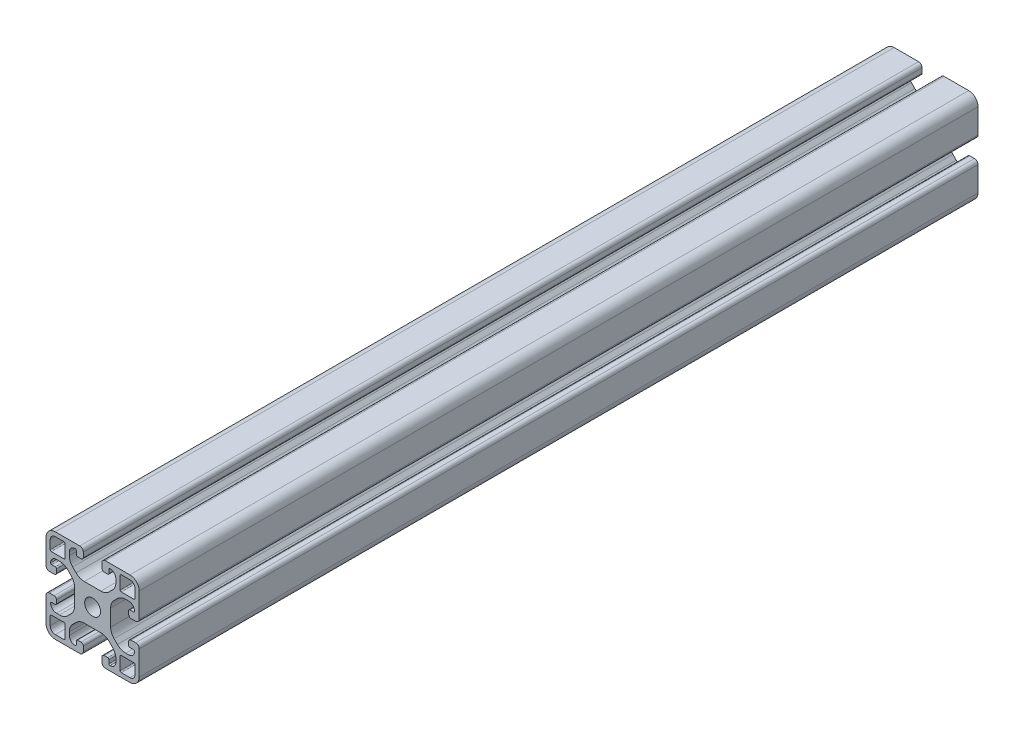
from build123d import *

# Parameters (mm, degrees)
SKETCH1_R          = 3.4
BASE_EXTRUDE_DEPTH = 360


with BuildPart() as part:
    # Sketch1 → Base-Extrude (new body)
    with BuildSketch(Plane.XY):
        with BuildLine():
            Line((226.84498689, 367.654619736), (226.84498689, 357.154619736))
            ThreePointArc((226.84498689, 357.154619736), (227.284326718, 356.093959564), (228.34498689, 355.654619736))
            Line((228.34498689, 355.654619736), (230.34498689, 355.654619736))
            ThreePointArc((230.34498689, 355.654619736), (231.052093671, 355.947512955), (231.34498689, 356.654619736))
            Line((231.34498689, 356.654619736), (231.34498689, 358.154619736))
            ThreePointArc((231.34498689, 358.154619736), (231.19854028, 358.508173127), (230.84498689, 358.654619736))
            Line((230.84498689, 358.654619736), (229.34498689, 358.654619736))
            ThreePointArc((229.34498689, 358.654619736), (228.991433499, 358.801066345), (228.84498689, 359.154619736))
            ThreePointArc((228.84498689, 359.154619736), (229.577219937, 360.922386689), (231.34498689, 361.654619736))
            Line((231.34498689, 361.654619736), (232.652598734, 361.654619736))
            ThreePointArc((232.652598734, 361.654619736), (234.566015896, 361.274017399), (236.18813264, 360.190153642))
            Line((236.18813264, 360.190153642), (237.630520795, 358.747765487))
            ThreePointArc((237.630520795, 358.747765487), (238.714384552, 357.125648743), (239.09498689, 355.212231581))
            Line((239.09498689, 355.212231581), (239.09498689, 351.654619736))
            Line((239.09498689, 351.654619736), (239.09498689, 348.097007892))
            ThreePointArc((239.09498689, 348.097007892), (238.714384552, 346.18359073), (237.630520795, 344.561473986))
            Line((237.630520795, 344.561473986), (236.18813264, 343.11908583))
            ThreePointArc((236.18813264, 343.11908583), (234.566015896, 342.035222074), (232.652598734, 341.654619736))
            Line((232.652598734, 341.654619736), (231.34498689, 341.654619736))
            ThreePointArc((231.34498689, 341.654619736), (229.577219937, 342.386852783), (228.84498689, 344.154619736))
            ThreePointArc((228.84498689, 344.154619736), (228.991433499, 344.508173127), (229.34498689, 344.654619736))
            Line((229.34498689, 344.654619736), (230.84498689, 344.654619736))
            ThreePointArc((230.84498689, 344.654619736), (231.19854028, 344.801066346), (231.34498689, 345.154619736))
            Line((231.34498689, 345.154619736), (231.34498689, 346.654619736))
            ThreePointArc((231.34498689, 346.654619736), (231.052093671, 347.361726517), (230.34498689, 347.654619736))
            Line((230.34498689, 347.654619736), (228.34498689, 347.654619736))
            ThreePointArc((228.34498689, 347.654619736), (227.284326718, 347.215279908), (226.84498689, 346.154619736))
            Line((226.84498689, 346.154619736), (226.84498689, 335.654619736))
            ThreePointArc((226.84498689, 335.654619736), (228.016559765, 332.826192611), (230.84498689, 331.654619736))
            Line((230.84498689, 331.654619736), (241.34498689, 331.654619736))
            ThreePointArc((241.34498689, 331.654619736), (242.405647061, 332.093959564), (242.84498689, 333.154619736))
            Line((242.84498689, 333.154619736), (242.84498689, 335.154619736))
            ThreePointArc((242.84498689, 335.154619736), (242.552093671, 335.861726517), (241.84498689, 336.154619736))
            Line((241.84498689, 336.154619736), (240.34498689, 336.154619736))
            ThreePointArc((240.34498689, 336.154619736), (239.991433499, 336.008173127), (239.84498689, 335.654619736))
            Line((239.84498689, 335.654619736), (239.84498689, 334.154619736))
            ThreePointArc((239.84498689, 334.154619736), (239.69854028, 333.801066346), (239.34498689, 333.654619736))
            ThreePointArc((239.34498689, 333.654619736), (237.577219937, 334.386852783), (236.84498689, 336.154619736))
            Line((236.84498689, 336.154619736), (236.84498689, 337.462231581))
            ThreePointArc((236.84498689, 337.462231581), (237.225589227, 339.375648743), (238.309452984, 340.997765487))
            Line((238.309452984, 340.997765487), (239.751841139, 342.440153642))
            ThreePointArc((239.751841139, 342.440153642), (241.373957883, 343.524017399), (243.287375045, 343.904619736))
            Line((243.287375045, 343.904619736), (246.84498689, 343.904619736))
            Line((246.84498689, 343.904619736), (250.402598734, 343.904619736))
            ThreePointArc((250.402598734, 343.904619736), (252.316015896, 343.524017399), (253.93813264, 342.440153642))
            Line((253.93813264, 342.440153642), (255.380520795, 340.997765487))
            ThreePointArc((255.380520795, 340.997765487), (256.464384552, 339.375648743), (256.84498689, 337.462231581))
            Line((256.84498689, 337.462231581), (256.84498689, 336.154619736))
            ThreePointArc((256.84498689, 336.154619736), (256.112753842, 334.386852783), (254.34498689, 333.654619736))
            ThreePointArc((254.34498689, 333.654619736), (253.991433499, 333.801066346), (253.84498689, 334.154619736))
            Line((253.84498689, 334.154619736), (253.84498689, 335.654619736))
            ThreePointArc((253.84498689, 335.654619736), (253.69854028, 336.008173127), (253.34498689, 336.154619736))
            Line((253.34498689, 336.154619736), (251.84498689, 336.154619736))
            ThreePointArc((251.84498689, 336.154619736), (251.137880108, 335.861726517), (250.84498689, 335.154619736))
            Line((250.84498689, 335.154619736), (250.84498689, 333.154619736))
            ThreePointArc((250.84498689, 333.154619736), (251.284326718, 332.093959564), (252.34498689, 331.654619736))
            Line((252.34498689, 331.654619736), (262.84498689, 331.654619736))
            ThreePointArc((262.84498689, 331.654619736), (265.673414014, 332.826192611), (266.84498689, 335.654619736))
            Line((266.84498689, 335.654619736), (266.84498689, 346.154619736))
            ThreePointArc((266.84498689, 346.154619736), (266.405647061, 347.215279908), (265.34498689, 347.654619736))
            Line((265.34498689, 347.654619736), (263.34498689, 347.654619736))
            ThreePointArc((263.34498689, 347.654619736), (262.637880108, 347.361726517), (262.34498689, 346.654619736))
            Line((262.34498689, 346.654619736), (262.34498689, 345.154619736))
            ThreePointArc((262.34498689, 345.154619736), (262.491433499, 344.801066346), (262.84498689, 344.654619736))
            Line((262.84498689, 344.654619736), (264.34498689, 344.654619736))
            ThreePointArc((264.34498689, 344.654619736), (264.69854028, 344.508173127), (264.84498689, 344.154619736))
            ThreePointArc((264.84498689, 344.154619736), (264.112753842, 342.386852783), (262.34498689, 341.654619736))
            Line((262.34498689, 341.654619736), (261.037375045, 341.654619736))
            ThreePointArc((261.037375045, 341.654619736), (259.123957883, 342.035222074), (257.501841139, 343.11908583))
            Line((257.501841139, 343.11908583), (256.059452984, 344.561473986))
            ThreePointArc((256.059452984, 344.561473986), (254.975589227, 346.18359073), (254.59498689, 348.097007892))
            Line((254.59498689, 348.097007892), (254.59498689, 351.654619736))
            Line((254.59498689, 351.654619736), (254.59498689, 355.212231581))
            ThreePointArc((254.59498689, 355.212231581), (254.975589227, 357.125648743), (256.059452984, 358.747765487))
            Line((256.059452984, 358.747765487), (257.501841139, 360.190153642))
            ThreePointArc((257.501841139, 360.190153642), (259.123957883, 361.274017399), (261.037375045, 361.654619736))
            Line((261.037375045, 361.654619736), (262.34498689, 361.654619736))
            ThreePointArc((262.34498689, 361.654619736), (264.112753842, 360.922386689), (264.84498689, 359.154619736))
            ThreePointArc((264.84498689, 359.154619736), (264.69854028, 358.801066345), (264.34498689, 358.654619736))
            Line((264.34498689, 358.654619736), (262.84498689, 358.654619736))
            ThreePointArc((262.84498689, 358.654619736), (262.491433499, 358.508173127), (262.34498689, 358.154619736))
            Line((262.34498689, 358.154619736), (262.34498689, 356.654619736))
            ThreePointArc((262.34498689, 356.654619736), (262.637880108, 355.947512955), (263.34498689, 355.654619736))
            Line((263.34498689, 355.654619736), (265.34498689, 355.654619736))
            ThreePointArc((265.34498689, 355.654619736), (266.405647061, 356.093959564), (266.84498689, 357.154619736))
            Line((266.84498689, 357.154619736), (266.84498689, 367.654619736))
            ThreePointArc((266.84498689, 367.654619736), (265.673414014, 370.483046861), (262.84498689, 371.654619736))
            Line((262.84498689, 371.654619736), (252.34498689, 371.654619736))
            ThreePointArc((252.34498689, 371.654619736), (251.284326718, 371.215279908), (250.84498689, 370.154619736))
            Line((250.84498689, 370.154619736), (250.84498689, 368.154619736))
            ThreePointArc((250.84498689, 368.154619736), (251.137880108, 367.447512955), (251.84498689, 367.154619736))
            Line((251.84498689, 367.154619736), (253.34498689, 367.154619736))
            ThreePointArc((253.34498689, 367.154619736), (253.69854028, 367.301066345), (253.84498689, 367.654619736))
            Line((253.84498689, 367.654619736), (253.84498689, 369.154619736))
            ThreePointArc((253.84498689, 369.154619736), (253.991433499, 369.508173127), (254.34498689, 369.654619736))
            ThreePointArc((254.34498689, 369.654619736), (256.112753842, 368.922386689), (256.84498689, 367.154619736))
            Line((256.84498689, 367.154619736), (256.84498689, 365.847007892))
            ThreePointArc((256.84498689, 365.847007892), (256.464384552, 363.93359073), (255.380520795, 362.311473986))
            Line((255.380520795, 362.311473986), (253.93813264, 360.86908583))
            ThreePointArc((253.93813264, 360.86908583), (252.316015896, 359.785222074), (250.402598734, 359.404619736))
            Line((250.402598734, 359.404619736), (246.84498689, 359.404619736))
            Line((246.84498689, 359.404619736), (243.287375045, 359.404619736))
            ThreePointArc((243.287375045, 359.404619736), (241.373957883, 359.785222074), (239.751841139, 360.86908583))
            Line((239.751841139, 360.86908583), (238.309452984, 362.311473986))
            ThreePointArc((238.309452984, 362.311473986), (237.225589227, 363.93359073), (236.84498689, 365.847007892))
            Line((236.84498689, 365.847007892), (236.84498689, 367.154619736))
            ThreePointArc((236.84498689, 367.154619736), (237.577219937, 368.922386689), (239.34498689, 369.654619736))
            ThreePointArc((239.34498689, 369.654619736), (239.69854028, 369.508173127), (239.84498689, 369.154619736))
            Line((239.84498689, 369.154619736), (239.84498689, 367.654619736))
            ThreePointArc((239.84498689, 367.654619736), (239.991433499, 367.301066345), (240.34498689, 367.154619736))
            Line((240.34498689, 367.154619736), (241.84498689, 367.154619736))
            ThreePointArc((241.84498689, 367.154619736), (242.552093671, 367.447512955), (242.84498689, 368.154619736))
            Line((242.84498689, 368.154619736), (242.84498689, 370.154619736))
            ThreePointArc((242.84498689, 370.154619736), (242.405647061, 371.215279908), (241.34498689, 371.654619736))
            Line((241.34498689, 371.654619736), (230.84498689, 371.654619736))
            ThreePointArc((230.84498689, 371.654619736), (228.016559765, 370.483046861), (226.84498689, 367.654619736))
        make_face()
        with Locations(Location((246.84498689, 351.654619736, 0), (0, 0, 180))):
            Circle(SKETCH1_R, mode=Mode.SUBTRACT)
        with BuildLine():
            Line((235.04498689, 333.954619736), (235.04498689, 339.354619736))
            ThreePointArc((235.04498689, 339.354619736), (234.89854028, 339.708173127), (234.54498689, 339.854619736))
            Line((234.54498689, 339.854619736), (229.14498689, 339.854619736))
            ThreePointArc((229.14498689, 339.854619736), (228.791433499, 339.708173127), (228.64498689, 339.354619736))
            Line((228.64498689, 339.354619736), (228.64498689, 335.654619736))
            ThreePointArc((228.64498689, 335.654619736), (229.289351971, 334.098984817), (230.84498689, 333.454619736))
            Line((230.84498689, 333.454619736), (234.54498689, 333.454619736))
            ThreePointArc((234.54498689, 333.454619736), (234.89854028, 333.601066346), (235.04498689, 333.954619736))
        make_face(mode=Mode.SUBTRACT)
        with BuildLine():
            Line((229.14498689, 363.454619736), (234.54498689, 363.454619736))
            ThreePointArc((234.54498689, 363.454619736), (234.89854028, 363.601066345), (235.04498689, 363.954619736))
            Line((235.04498689, 363.954619736), (235.04498689, 369.354619736))
            ThreePointArc((235.04498689, 369.354619736), (234.89854028, 369.708173127), (234.54498689, 369.854619736))
            Line((234.54498689, 369.854619736), (230.84498689, 369.854619736))
            ThreePointArc((230.84498689, 369.854619736), (229.289351971, 369.210254655), (228.64498689, 367.654619736))
            Line((228.64498689, 367.654619736), (228.64498689, 363.954619736))
            ThreePointArc((228.64498689, 363.954619736), (228.791433499, 363.601066345), (229.14498689, 363.454619736))
        make_face(mode=Mode.SUBTRACT)
        with BuildLine():
            Line((264.54498689, 339.854619736), (259.14498689, 339.854619736))
            ThreePointArc((259.14498689, 339.854619736), (258.791433499, 339.708173127), (258.64498689, 339.354619736))
            Line((258.64498689, 339.354619736), (258.64498689, 333.954619736))
            ThreePointArc((258.64498689, 333.954619736), (258.791433499, 333.601066346), (259.14498689, 333.454619736))
            Line((259.14498689, 333.454619736), (262.84498689, 333.454619736))
            ThreePointArc((262.84498689, 333.454619736), (264.400621808, 334.098984817), (265.04498689, 335.654619736))
            Line((265.04498689, 335.654619736), (265.04498689, 339.354619736))
            ThreePointArc((265.04498689, 339.354619736), (264.89854028, 339.708173127), (264.54498689, 339.854619736))
        make_face(mode=Mode.SUBTRACT)
        with BuildLine():
            Line((258.64498689, 369.354619736), (258.64498689, 363.954619736))
            ThreePointArc((258.64498689, 363.954619736), (258.791433499, 363.601066346), (259.14498689, 363.454619736))
            Line((259.14498689, 363.454619736), (264.54498689, 363.454619736))
            ThreePointArc((264.54498689, 363.454619736), (264.89854028, 363.601066346), (265.04498689, 363.954619736))
            Line((265.04498689, 363.954619736), (265.04498689, 367.654619736))
            ThreePointArc((265.04498689, 367.654619736), (264.400621808, 369.210254655), (262.84498689, 369.854619736))
            Line((262.84498689, 369.854619736), (259.14498689, 369.854619736))
            ThreePointArc((259.14498689, 369.854619736), (258.791433499, 369.708173127), (258.64498689, 369.354619736))
        make_face(mode=Mode.SUBTRACT)
    extrude(amount=BASE_EXTRUDE_DEPTH)


solid = part.part
